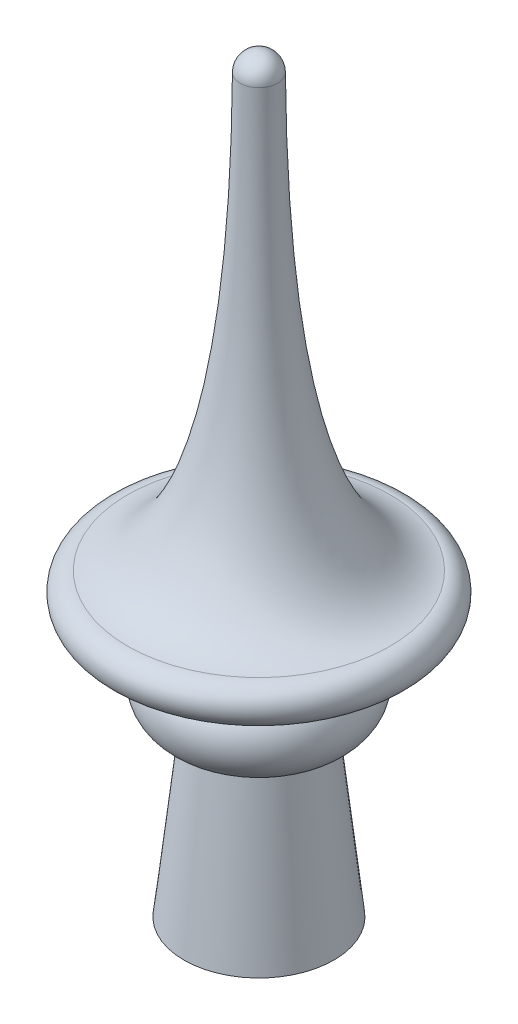
from build123d import *

# Parameters (mm, degrees)
SKETCH2_R          = 12.5
CUT_EXTRUDE1_DEPTH = 70


with BuildPart() as part:
    # Sketch1 → Revolve1 (revolve)
    with BuildSketch(Plane.XY, mode=Mode.PRIVATE) as revolve1_sk:
        with BuildLine():
            Line((15, 70), (35, 70))
            ThreePointArc((35, 70), (40, 75), (35, 80))
            add(Edge.make_bspline(
                [(5, 195), (5.717546725, 84.963174913), (35, 80)],
                knots=[0, 0, 0, 1, 1, 1], degree=2))
            ThreePointArc((5, 195), (3.535533906, 198.535533906), (0, 200))
            Line((0, 200), (0, 0))
            Line((0, 0), (20, 0))
            Line((20, 0), (15, 45))
            ThreePointArc((15, 45), (25, 55), (15, 65))
            Line((15, 65), (15, 70))
        make_face()
    revolve(revolve1_sk.sketch.rotate(Axis((0, 200, 0), (0, -1, 0)), 90), axis=Axis((0, 200, 0), (0, -1, 0)))

    # Sketch2 → Cut-Extrude1 (cut)
    with BuildSketch(Plane.XZ):
        with Locations(Location((0, 0, 0), (0, 0, 270))):
            Circle(SKETCH2_R)
    extrude(amount=-CUT_EXTRUDE1_DEPTH, mode=Mode.SUBTRACT)


solid = part.part
